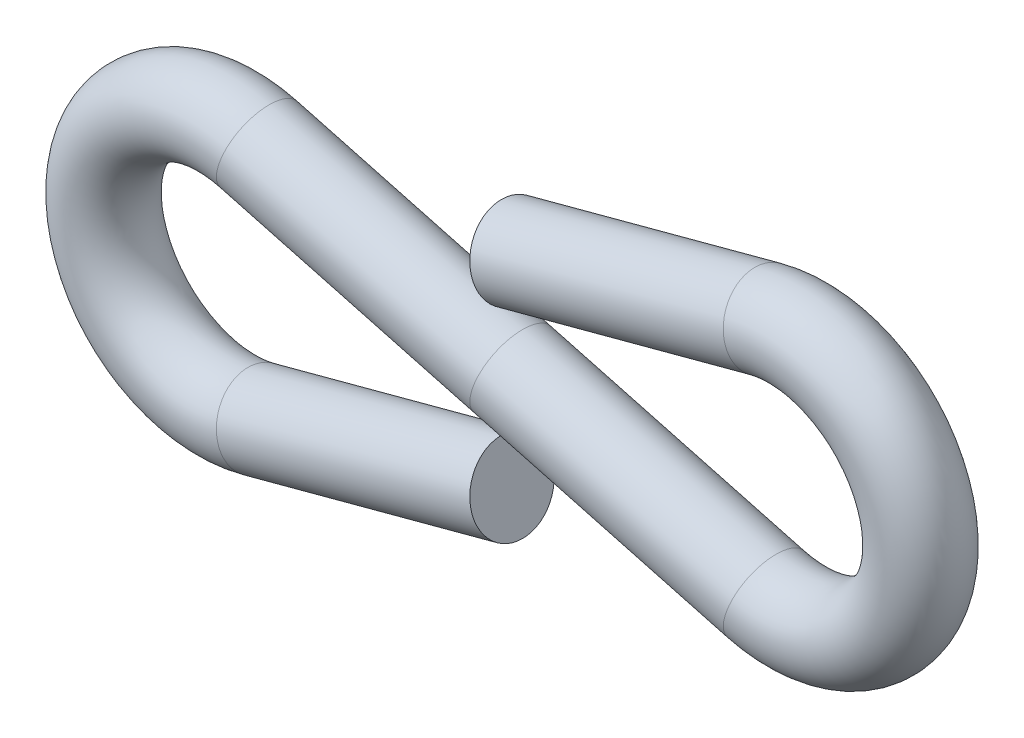
from build123d import *

# Parameters (mm, degrees)
SWEEP_1_PROFILE_R = 3


with BuildPart() as part:
    # По траектории1: sweep along a path in Эскиз1
    with BuildLine(Plane.XY) as sweep_1_path:
        Line((0, 7.5), (18.613206798, 12.48739373))
        ThreePointArc((18.613206798, 12.48739373), (30, 3.75), (18.613206798, -4.98739373))
        Line((18.613206798, -4.98739373), (0, 0))
        Line((0, 0), (-18.613206798, 4.98739373))
        ThreePointArc((-18.613206798, 4.98739373), (-30, -3.75), (-18.613206798, -12.48739373))
        Line((-18.613206798, -12.48739373), (0, -7.5))
    # По траектории1 profile (on start of the path) → По траектории1 (sweep)
    with BuildSketch(Plane(origin=(0, 7.5, 0), x_dir=(-0.25881904510251785, 0.9659258262890691, 0), z_dir=(0.9659258262890691, 0.25881904510251785, 0))):
        Circle(SWEEP_1_PROFILE_R)
    sweep(path=sweep_1_path.line)


solid = part.part
